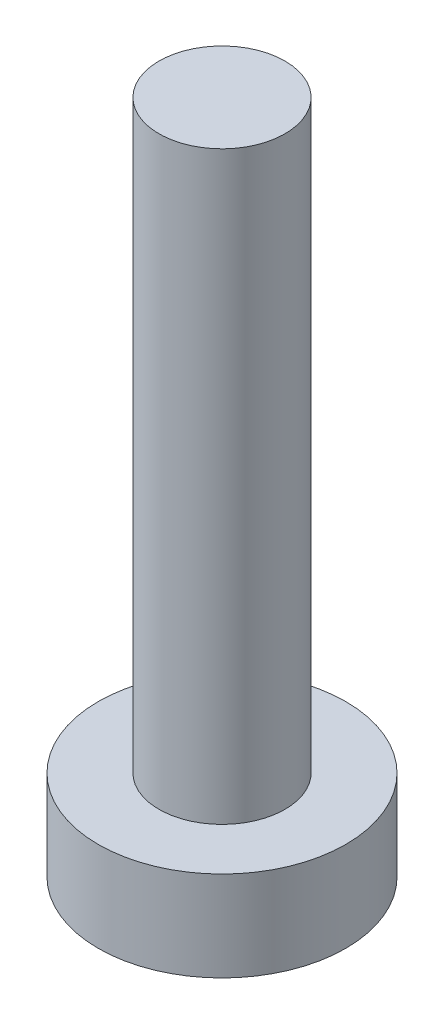
from build123d import *

# Parameters (mm, degrees)
SKETCH2_R           = 2.75
BOSS_EXTRUDE1_DEPTH = 2
SKETCH3_R           = 1.4
BOSS_EXTRUDE2_DEPTH = 13
CUT_EXTRUDE1_DEPTH  = 1.5


with BuildPart() as part:
    # Sketch2 → Boss-Extrude1 (new body)
    with BuildSketch(Plane(origin=(0, 0, 0), x_dir=(1, 0, 0), z_dir=(0, 1, 0))):
        with Locations(Location((0, 0, 0), (0, 0, 270))):
            Circle(SKETCH2_R)
    extrude(amount=BOSS_EXTRUDE1_DEPTH)

    # Sketch3 → Boss-Extrude2 (add)
    with BuildSketch(Plane(origin=(0, 2, 0), x_dir=(1, 0, 0), z_dir=(0, 1, 0))):
        with Locations(Location((0, 0, 0), (0, 0, 90))):
            Circle(SKETCH3_R)
    extrude(amount=BOSS_EXTRUDE2_DEPTH)

    # Sketch4 → Cut-Extrude1 (cut)
    with BuildSketch(Plane.XZ):
        Polygon((1.154700538, 0), (0.577350269, 1), (-0.577350269, 1), (-1.154700538, 0), (-0.577350269, -1), (0.577350269, -1), align=None)
    extrude(amount=-CUT_EXTRUDE1_DEPTH, mode=Mode.SUBTRACT)


solid = part.part
